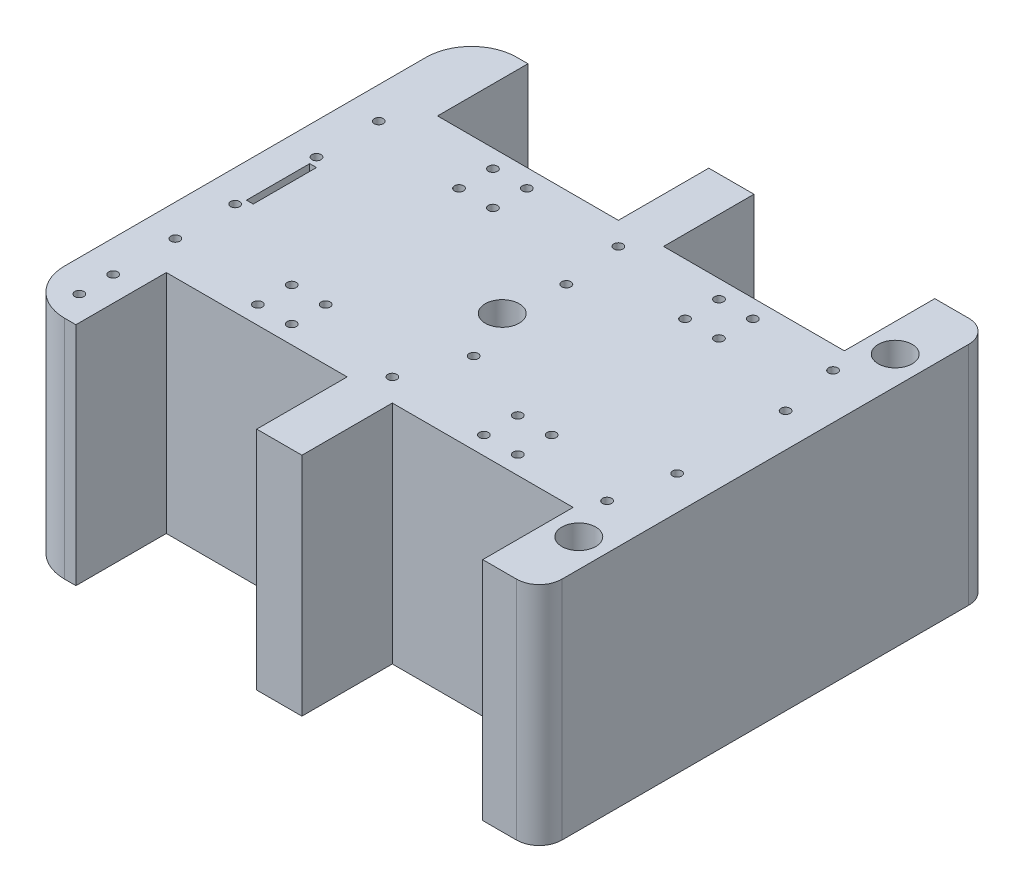
from build123d import *

# Parameters (mm, degrees)
CROQUIS1_R              = 7.5
CROQUIS1_R_2            = 2
CROQUIS1_W              = 3
CROQUIS1_H              = 28
SALIENTE_EXTRUIR1_DEPTH = 100
CROQUIS2_R              = 7.5
SALIENTE_EXTRUIR2_DEPTH = 115
CROQUIS3_R              = 2
CORTAR_EXTRUIR2_DEPTH   = 149
CROQUIS4_R              = 2
SALIENTE_EXTRUIR3_DEPTH = 86
CROQUIS5_R              = 2
CORTAR_EXTRUIR3_DEPTH   = 139
CROQUIS7_R              = 2
CORTAR_EXTRUIR4_DEPTH   = 139
CROQUIS8_R              = 2
SALIENTE_EXTRUIR4_DEPTH = 78
CROQUIS9_R              = 2
CORTAR_EXTRUIR5_DEPTH   = 117


with BuildPart() as part:
    # Croquis1 → Saliente-Extruir1 (new body)
    with BuildSketch(Plane(origin=(0, 0, 0), x_dir=(1, 0, 0), z_dir=(0, 1, 0))):
        with BuildLine():
            Line((0, 0), (0, 40))
            Line((0, 40), (80, 40))
            Line((80, 40), (80, 0))
            Line((80, 0), (100, 0))
            Line((100, 0), (100, 40))
            Line((100, 40), (180, 40))
            Line((180, 40), (180, 0))
            Line((180, 0), (195, 0))
            ThreePointArc((195, 0), (202.071067812, 2.928932188), (205, 10))
            Line((205, 10), (205, 190))
            ThreePointArc((205, 190), (202.071067812, 197.071067812), (195, 200))
            Line((195, 200), (180, 200))
            Line((180, 200), (180, 160))
            Line((180, 160), (100, 160))
            Line((100, 160), (100, 200))
            Line((100, 200), (80, 200))
            Line((80, 200), (80, 160))
            Line((80, 160), (0, 160))
            Line((0, 160), (0, 200))
            Line((0, 200), (-5, 200))
            ThreePointArc((-5, 200), (-19.142135624, 194.142135624), (-25, 180))
            Line((-25, 180), (-25, 20))
            ThreePointArc((-25, 20), (-19.142135624, 5.857864376), (-5, 0))
            Line((-5, 0), (0, 0))
        make_face()
        with Locations(Location((-5, 70, 0), (0, 0, 270))):
            Circle(CROQUIS1_R, mode=Mode.SUBTRACT)
        with Locations(Location((-5, 130, 0), (0, 0, 270))):
            Circle(CROQUIS1_R, mode=Mode.SUBTRACT)
        with Locations(Location((192.5, 170, 0), (0, 0, 270))):
            Circle(CROQUIS1_R, mode=Mode.SUBTRACT)
        with Locations(Location((192.5, 30, 0), (0, 0, 270))):
            Circle(CROQUIS1_R, mode=Mode.SUBTRACT)
        with Locations(Location((90, 98.617815675, 0), (0, 0, 270))):
            Circle(CROQUIS1_R, mode=Mode.SUBTRACT)
        with Locations(Location((32.5, 152, 0), (0, 0, 270))):
            Circle(CROQUIS1_R_2, mode=Mode.SUBTRACT)
        with Locations(Location((47.5, 152, 0), (0, 0, 270))):
            Circle(CROQUIS1_R_2, mode=Mode.SUBTRACT)
        with Locations(Location((47.5, 137, 0), (0, 0, 270))):
            Circle(CROQUIS1_R_2, mode=Mode.SUBTRACT)
        with Locations(Location((32.5, 137, 0), (0, 0, 270))):
            Circle(CROQUIS1_R_2, mode=Mode.SUBTRACT)
        with Locations(Location((32.5, 48, 0), (0, 0, 270))):
            Circle(CROQUIS1_R_2, mode=Mode.SUBTRACT)
        with Locations(Location((32.5, 63, 0), (0, 0, 270))):
            Circle(CROQUIS1_R_2, mode=Mode.SUBTRACT)
        with Locations(Location((47.5, 48, 0), (0, 0, 270))):
            Circle(CROQUIS1_R_2, mode=Mode.SUBTRACT)
        with Locations(Location((47.5, 63, 0), (0, 0, 270))):
            Circle(CROQUIS1_R_2, mode=Mode.SUBTRACT)
        with Locations(Location((132.5, 152, 0), (0, 0, 270))):
            Circle(CROQUIS1_R_2, mode=Mode.SUBTRACT)
        with Locations(Location((132.5, 137, 0), (0, 0, 270))):
            Circle(CROQUIS1_R_2, mode=Mode.SUBTRACT)
        with Locations(Location((147.5, 152, 0), (0, 0, 270))):
            Circle(CROQUIS1_R_2, mode=Mode.SUBTRACT)
        with Locations(Location((147.5, 137, 0), (0, 0, 270))):
            Circle(CROQUIS1_R_2, mode=Mode.SUBTRACT)
        with Locations(Location((132.5, 63, 0), (0, 0, 270))):
            Circle(CROQUIS1_R_2, mode=Mode.SUBTRACT)
        with Locations(Location((132.5, 48, 0), (0, 0, 270))):
            Circle(CROQUIS1_R_2, mode=Mode.SUBTRACT)
        with Locations(Location((147.5, 63, 0), (0, 0, 270))):
            Circle(CROQUIS1_R_2, mode=Mode.SUBTRACT)
        with Locations(Location((147.5, 48, 0), (0, 0, 270))):
            Circle(CROQUIS1_R_2, mode=Mode.SUBTRACT)
        with Locations(Location((90, 50, 0), (0, 0, 270))):
            Circle(CROQUIS1_R_2, mode=Mode.SUBTRACT)
        with Locations(Location((185, 50, 0), (0, 0, 270))):
            Circle(CROQUIS1_R_2, mode=Mode.SUBTRACT)
        with Locations(Location((185, 150, 0), (0, 0, 270))):
            Circle(CROQUIS1_R_2, mode=Mode.SUBTRACT)
        with Locations(Location((90, 150, 0), (0, 0, 270))):
            Circle(CROQUIS1_R_2, mode=Mode.SUBTRACT)
        with Locations((-8.5, 99.450016357)):
            Rectangle(CROQUIS1_W, CROQUIS1_H, mode=Mode.SUBTRACT)
    extrude(amount=-SALIENTE_EXTRUIR1_DEPTH)

    # Croquis2 → Saliente-Extruir2 (add)
    with BuildSketch(Plane(origin=(0, 0, 0), x_dir=(1, 0, 0), z_dir=(0, 1, 0))):
        with Locations(Location((-5, 130, 0), (0, 0, 270))):
            Circle(CROQUIS2_R)
        with Locations(Location((-5, 70, 0), (0, 0, 270))):
            Circle(CROQUIS2_R)
    extrude(amount=-SALIENTE_EXTRUIR2_DEPTH)

    # Croquis3 → Cortar-Extruir2 (cut)
    with BuildSketch(Plane(origin=(0, 0, 0), x_dir=(1, 0, 0), z_dir=(0, 1, 0))):
        with Locations(Location((-11, 117.450016357, 0), (0, 0, 270))):
            Circle(CROQUIS3_R)
        with Locations(Location((-11, 81.450016357, 0), (0, 0, 270))):
            Circle(CROQUIS3_R)
        with Locations(Location((190, 76, 0), (0, 0, 270))):
            Circle(CROQUIS3_R)
        with Locations(Location((-12.5, 25.729751891, 0), (0, 0, 270))):
            Circle(CROQUIS3_R)
        with Locations(Location((-12.5, 10.729751891, 0), (0, 0, 270))):
            Circle(CROQUIS3_R)
        with Locations(Location((190, 124, 0), (0, 0, 270))):
            Circle(CROQUIS3_R)
        with Locations(Location((93, 124, 0), (0, 0, 270))):
            Circle(CROQUIS3_R)
        with Locations(Location((100, 76, 0), (0, 0, 270))):
            Circle(CROQUIS3_R)
    extrude(amount=-CORTAR_EXTRUIR2_DEPTH, mode=Mode.SUBTRACT)

    # Croquis4 → Saliente-Extruir3 (add)
    with BuildSketch(Plane(origin=(0, 0, 0), x_dir=(1, 0, 0), z_dir=(0, 1, 0))):
        with Locations(Location((-12.5, 25.729751891, 0), (0, 0, 270))):
            Circle(CROQUIS4_R)
        with Locations(Location((-12.5, 10.729751891, 0), (0, 0, 270))):
            Circle(CROQUIS4_R)
    extrude(amount=-SALIENTE_EXTRUIR3_DEPTH)

    # Croquis5 → Cortar-Extruir3 (cut)
    with BuildSketch(Plane(origin=(0, 0, 0), x_dir=(1, 0, 0), z_dir=(0, 1, 0))):
        with Locations(Location((-11, 40, 0), (0, 0, 270))):
            Circle(CROQUIS5_R)
        with Locations(Location((-11, 25, 0), (0, 0, 270))):
            Circle(CROQUIS5_R)
    extrude(amount=-CORTAR_EXTRUIR3_DEPTH, mode=Mode.SUBTRACT)

    # Croquis7 → Cortar-Extruir4 (cut)
    with BuildSketch(Plane(origin=(0, 0, 0), x_dir=(1, 0, 0), z_dir=(0, 1, 0))):
        with Locations(Location((-11, 145, 0), (0, 0, 270))):
            Circle(CROQUIS7_R)
        with Locations(Location((-11, 55, 0), (0, 0, 270))):
            Circle(CROQUIS7_R)
    extrude(amount=-CORTAR_EXTRUIR4_DEPTH, mode=Mode.SUBTRACT)

    # Croquis8 → Saliente-Extruir4 (add)
    with BuildSketch(Plane(origin=(0, 0, 0), x_dir=(1, 0, 0), z_dir=(0, 1, 0))):
        with Locations(Location((-11, 40, 0), (0, 0, 270))):
            Circle(CROQUIS8_R)
        with Locations(Location((-11, 25, 0), (0, 0, 270))):
            Circle(CROQUIS8_R)
    extrude(amount=-SALIENTE_EXTRUIR4_DEPTH)

    # Croquis9 → Cortar-Extruir5 (cut)
    with BuildSketch(Plane(origin=(0, 0, 0), x_dir=(1, 0, 0), z_dir=(0, 1, 0))):
        with Locations(Location((-11, 27.5, 0), (0, 0, 270))):
            Circle(CROQUIS9_R)
        with Locations(Location((-11, 12.5, 0), (0, 0, 270))):
            Circle(CROQUIS9_R)
    extrude(amount=-CORTAR_EXTRUIR5_DEPTH, mode=Mode.SUBTRACT)


solid = part.part
